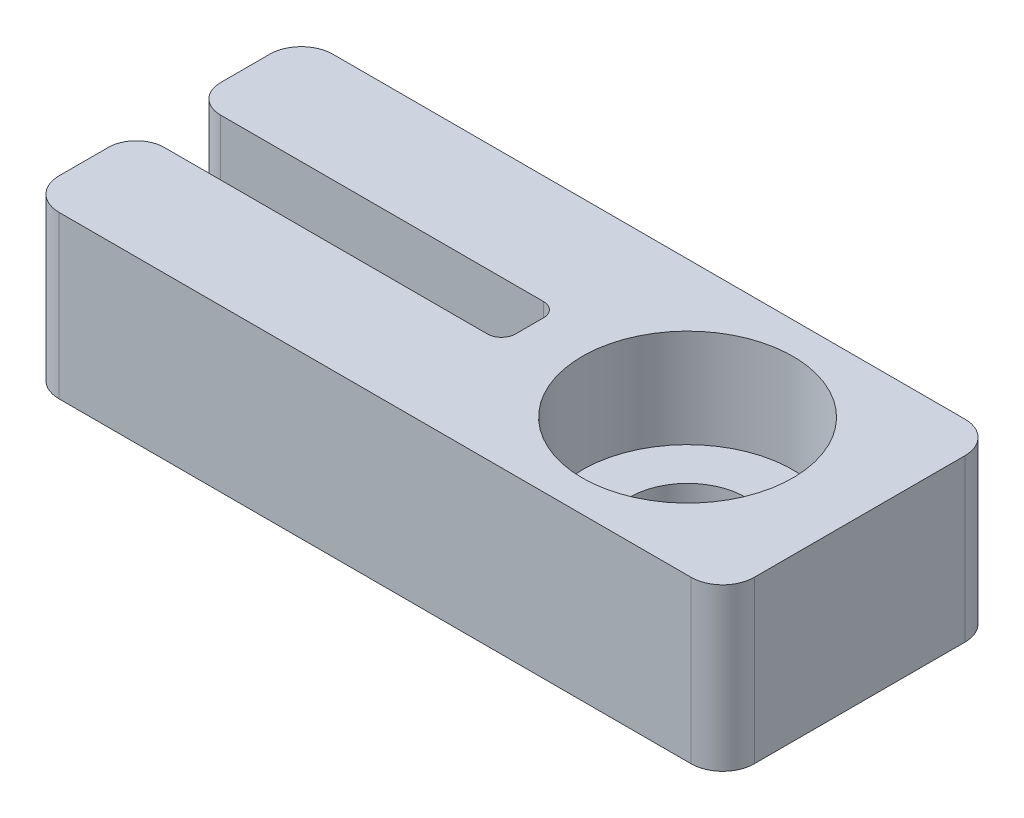
from build123d import *

# Parameters (mm, degrees)
SKETCH_1_R          = 1.65
EXTRUDE_1_DEPTH     = 4.6
CUT_EXTRUDE_1_DEPTH = 4.6
FILLET_1_R          = 0.8
SKETCH_3_R          = 3
CUT_EXTRUDE_2_DEPTH = 2.8


with BuildPart() as part:
    # 草图1 → 凸台-拉伸1 (new body)
    with BuildSketch(Plane(origin=(0, 0, 0), x_dir=(1, 0, 0), z_dir=(0, 1, 0))):
        with BuildLine():
            Line((-9.9, -3), (-9.9, 3))
            ThreePointArc((-9.9, 3), (-9.636396103, 3.636396103), (-9, 3.9))
            Line((-9, 3.9), (9, 3.9))
            ThreePointArc((9, 3.9), (9.636396103, 3.636396103), (9.9, 3))
            Line((9.9, 3), (9.9, -3))
            ThreePointArc((9.9, -3), (9.636396103, -3.636396103), (9, -3.9))
            Line((9, -3.9), (-9, -3.9))
            ThreePointArc((-9, -3.9), (-9.636396103, -3.636396103), (-9.9, -3))
        make_face()
        with Locations(Location((5, 0, 0), (0, 0, 270))):
            Circle(SKETCH_1_R, mode=Mode.SUBTRACT)
    extrude(amount=EXTRUDE_1_DEPTH)

    # 草图2 → 切除-拉伸1 (cut)
    with BuildSketch(Plane(origin=(0, 4.6, 0), x_dir=(1, 0, 0), z_dir=(0, 1, 0))):
        with BuildLine():
            Line((-10.1, 0.8), (0.1, 0.8))
            ThreePointArc((0.1, 0.8), (0.382842712, 0.682842712), (0.5, 0.4))
            Line((0.5, 0.4), (0.5, -0.4))
            ThreePointArc((0.5, -0.4), (0.382842712, -0.682842712), (0.1, -0.8))
            Line((0.1, -0.8), (-10.1, -0.8))
            ThreePointArc((-10.1, -0.8), (-10.382842712, -0.682842712), (-10.5, -0.4))
            Line((-10.5, -0.4), (-10.5, 0.4))
            ThreePointArc((-10.5, 0.4), (-10.382842712, 0.682842712), (-10.1, 0.8))
        make_face()
    extrude(amount=-CUT_EXTRUDE_1_DEPTH, mode=Mode.SUBTRACT)

    # 圆角1
    fillet_1_edges = [part.edges().sort_by_distance(p)[0] for p in [
        (-9.9, 2.3, 0.8),
        (-9.9, 2.3, -0.8),
    ]]
    fillet(fillet_1_edges, radius=FILLET_1_R)

    # 草图3 → 切除-拉伸2 (cut)
    with BuildSketch(Plane(origin=(0, 4.6, 0), x_dir=(1, 0, 0), z_dir=(0, 1, 0))):
        with Locations(Location((5, 0, 0), (0, 0, 270))):
            Circle(SKETCH_3_R)
    extrude(amount=-CUT_EXTRUDE_2_DEPTH, mode=Mode.SUBTRACT)


solid = part.part
